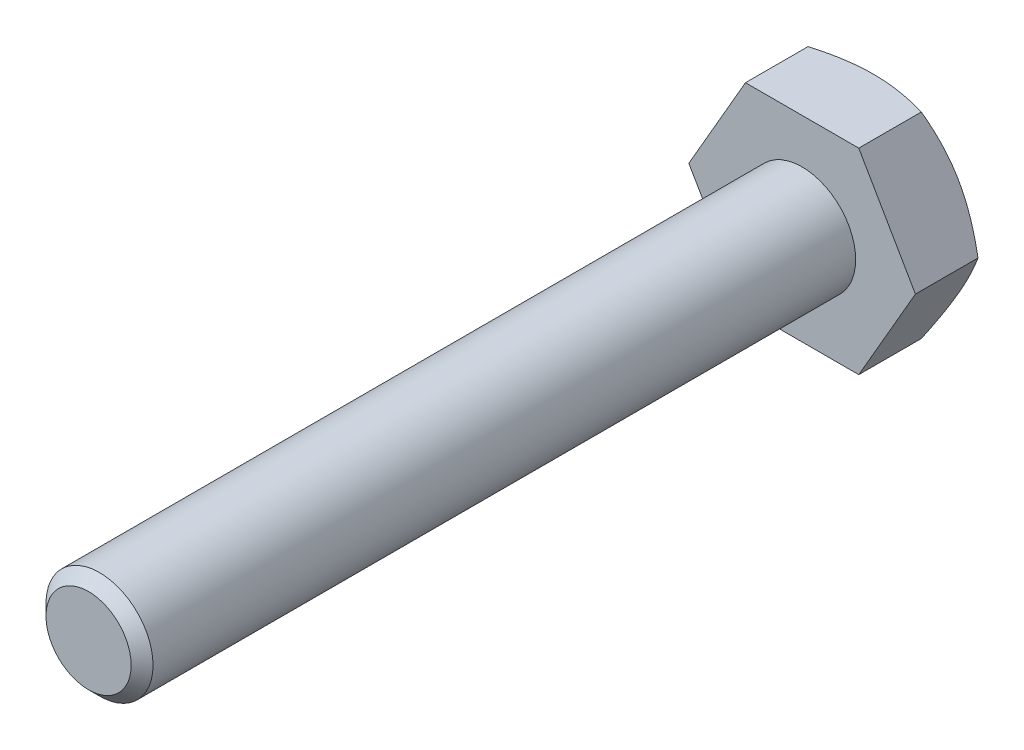
from build123d import *

# Parameters (mm, degrees)
EXTRUDE1_DEPTH = 2
SKETCH2_R      = 1.5
EXTRUDE2_DEPTH = 20
CHAMFER1_SIZE  = 0.307


with BuildPart() as part:
    # Sketch1 → Extrude1 (new body)
    with BuildSketch(Plane.XY):
        Polygon((3.175426481, 0), (1.58771324, 2.75), (-1.58771324, 2.75), (-3.175426481, 0), (-1.58771324, -2.75), (1.58771324, -2.75), align=None)
    extrude(amount=EXTRUDE1_DEPTH)

    # Sketch2 → Extrude2 (add)
    with BuildSketch(Plane.XY.offset(2)):
        Circle(SKETCH2_R)
    extrude(amount=EXTRUDE2_DEPTH)

    # Sketch3 → Cut-Revolve1 (revolve, cut)
    with BuildSketch(Plane(origin=(0, 0, 0), x_dir=(0, 0, -1), z_dir=(1, 0, 0))):
        Polygon((0, 2.75), (0, 102.75), (-57.735026919, 102.75), align=None)
    revolve(axis=Axis((0, 0, 0), (0, 0, -1)), mode=Mode.SUBTRACT)

    # Chamfer1
    chamfer1_edges = [part.edges().sort_by_distance(p)[0] for p in [
        (-1.5, 0, 22),
    ]]
    chamfer(chamfer1_edges, length=CHAMFER1_SIZE)


solid = part.part
